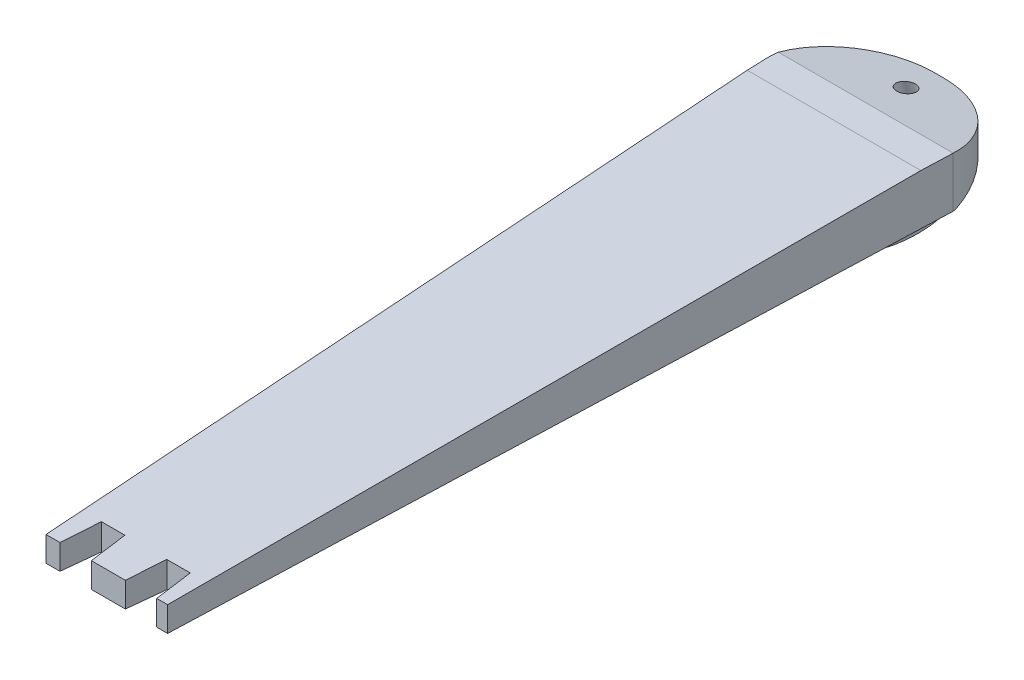
from build123d import *

# Parameters (mm, degrees)
AUFSATZ_LINEAR_AUSTRAGEN1_DEPTH      = 6
SCHNITT_LINEAR_AUSTRAGEN1_DEPTH      = 72.169611735
SCHNITT_LINEAR_AUSTRAGEN1_DEPTH_BACK = 72.169611735
SCHNITT_LINEAR_AUSTRAGEN2_DEPTH      = 72.169611735
SCHNITT_LINEAR_AUSTRAGEN2_DEPTH_BACK = 72.169611735
AUFSATZ_LINEAR_AUSTRAGEN2_DEPTH      = 4
SCHNITT_LINEAR_AUSTRAGEN3_DEPTH      = 72.169611735
SCHNITT_LINEAR_AUSTRAGEN3_DEPTH_BACK = 72.169611735
SKIZZE7_R                            = 1.05
SCHNITT_LINEAR_AUSTRAGEN4_DEPTH      = 5


with BuildPart() as part:
    # Skizze1 → Aufsatz-Linear austragen1 (new body)
    with BuildSketch(Plane(origin=(0, 0, 0), x_dir=(1, 0, 0), z_dir=(0, 1, 0))):
        with BuildLine():
            Line((9.557167706, 20.388739502), (6.321745697, -70))
            Line((6.321745697, -70), (5.021745697, -70))
            Line((5.021745697, -70), (4.552285436, -65.533383981))
            Line((4.552285436, -65.533383981), (1.752285436, -65.533383981))
            Line((1.752285436, -65.533383981), (1.282825175, -70))
            Line((1.282825175, -70), (-2.768942942, -70))
            Line((-2.768942942, -70), (-3.238403203, -65.533383981))
            Line((-3.238403203, -65.533383981), (-6.038403203, -65.533383981))
            Line((-6.038403203, -65.533383981), (-6.507863464, -70))
            Line((-6.507863464, -70), (-8.17258631, -70))
            Line((-8.17258631, -70), (-11.362818073, 19.126249046))
            ThreePointArc((-11.362818073, 19.126249046), (-8.433885885, 26.197316858), (-1.362818073, 29.126249046))
            Line((-1.362818073, 29.126249046), (-0.362818073, 29.126249046))
            ThreePointArc((-0.362818073, 29.126249046), (6.24683757, 26.630411376), (9.557167706, 20.388739502))
        make_face()
    extrude(amount=AUFSATZ_LINEAR_AUSTRAGEN1_DEPTH)

    # Skizze3 → Schnitt-Linear austragen1 (cut, two sides: drawn at the far end of the back side and taken through both)
    with BuildSketch(Plane(origin=(0, 0, 0), x_dir=(0, 0, -1), z_dir=(1, 0, 0)).offset(-SCHNITT_LINEAR_AUSTRAGEN1_DEPTH_BACK)):
        Polygon((16.673690486, 6), (-70, 6), (-70, 2.973288034), align=None)
    extrude(amount=SCHNITT_LINEAR_AUSTRAGEN1_DEPTH + SCHNITT_LINEAR_AUSTRAGEN1_DEPTH_BACK, mode=Mode.SUBTRACT)

    # Skizze4 → Schnitt-Linear austragen2 (cut, two sides: drawn at the far end of the back side and taken through both)
    with BuildSketch(Plane(origin=(0, 0, 0), x_dir=(0, 0, -1), z_dir=(1, 0, 0)).offset(-SCHNITT_LINEAR_AUSTRAGEN2_DEPTH_BACK)):
        Polygon((20.388739502, 6), (29.126249046, 4.459341323), (29.126249046, 6), align=None)
    extrude(amount=SCHNITT_LINEAR_AUSTRAGEN2_DEPTH + SCHNITT_LINEAR_AUSTRAGEN2_DEPTH_BACK, mode=Mode.SUBTRACT)

    # Skizze5 → Aufsatz-Linear austragen2 (add)
    with BuildSketch(Plane.XZ):
        with BuildLine():
            Line((-7.933885885, -12.055181234), (-7.933885885, -3.371441204))
            Line((-7.933885885, -3.371441204), (6.208249739, -3.371441204))
            Line((6.208249739, -3.371441204), (6.208249739, -12.055181234))
            ThreePointArc((6.208249739, -12.055181234), (-0.862818073, -29.126249046), (-7.933885885, -12.055181234))
        make_face()
    extrude(amount=AUFSATZ_LINEAR_AUSTRAGEN2_DEPTH)

    # Skizze6 → Schnitt-Linear austragen3 (cut, two sides: drawn at the far end of the back side and taken through both)
    with BuildSketch(Plane(origin=(0, 0, 0), x_dir=(0, 0, -1), z_dir=(1, 0, 0)).offset(-SCHNITT_LINEAR_AUSTRAGEN3_DEPTH_BACK)):
        Polygon((12.066816312, -1.992514478), (29.126249046, 1.945965899), (29.126249046, -4), (3.371441204, -4), (3.371441204, -2), align=None)
    extrude(amount=SCHNITT_LINEAR_AUSTRAGEN3_DEPTH + SCHNITT_LINEAR_AUSTRAGEN3_DEPTH_BACK, mode=Mode.SUBTRACT)

    # Skizze7 → Schnitt-Linear austragen4 (cut)
    with BuildSketch(Plane(origin=(0, -4.536559366, -1.047347255), x_dir=(1, 0, 0), z_dir=(0, -0.9743700647852368, -0.22495105434385881))):
        with Locations(Location((-0.862818073, -14.009326359, 0), (0, 0, 270))):
            Circle(SKIZZE7_R)
        with Locations(Location((-0.862818073, -17.909326359, 0), (0, 0, 270))):
            Circle(SKIZZE7_R)
        with Locations(Location((-0.862818073, -21.809326359, 0), (0, 0, 270))):
            Circle(SKIZZE7_R)
        with Locations(Location((-0.862818073, -25.709326359, 0), (0, 0, 270))):
            Circle(SKIZZE7_R)
    extrude(amount=-SCHNITT_LINEAR_AUSTRAGEN4_DEPTH, mode=Mode.SUBTRACT)


solid = part.part
